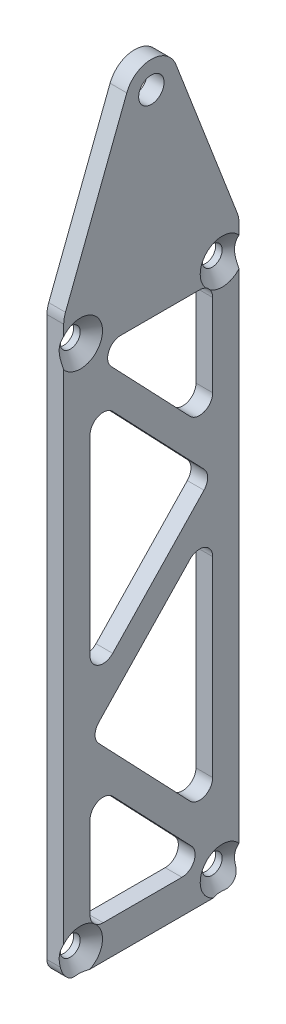
from build123d import *

# Parameters (mm, degrees)
SKETCH1_W                                 = 41.514809608
SKETCH1_H                                 = 98.81
SKETCH1_R                                 = 1.8288
SKETCH1_R_2                               = 2.413
BOSS_EXTRUDE1_DEPTH                       = 3.175
SKETCH2_W                                 = 4.112404804
SKETCH2_H                                 = 141.223
CUT_EXTRUDE1_DEPTH                        = 106.912542124
FILLET1_R                                 = 2.5
FILLET2_R                                 = 5
CSK_FOR_6_FLAT_HEAD_MACHINE_SCREW_2_COUNT = 2
CSK_FOR_6_FLAT_HEAD_MACHINE_SCREW_2_PITCH = 26.9494
CSK_FOR_6_FLAT_HEAD_MACHINE_SCREW_3_COUNT = 2
CSK_FOR_6_FLAT_HEAD_MACHINE_SCREW_3_PITCH = 103.567708096
CSK_FOR_6_FLAT_HEAD_MACHINE_SCREW_4_COUNT = 2
CSK_FOR_6_FLAT_HEAD_MACHINE_SCREW_4_PITCH = 100


with BuildPart() as part:
    # Sketch1 → Boss-Extrude1 (new body)
    # profile 1 of 6: a face of its own
    with BuildSketch(Plane(origin=(0, 0, 0), x_dir=(0, 0, -1), z_dir=(1, 0, 0))):
        with Locations((0, -54.405)):
            Rectangle(SKETCH1_W, SKETCH1_H)
        with Locations((13.4747, -100)):
            Circle(SKETCH1_R, mode=Mode.SUBTRACT)
        with Locations((-13.4747, -100)):
            Circle(SKETCH1_R, mode=Mode.SUBTRACT)
    # profile 2 of 6: a face of its own
    with BuildSketch(Plane(origin=(0, 0, 0), x_dir=(0, 0, -1), z_dir=(1, 0, 0))):
        Polygon((0, 48.916537522), (20.757404804, -5), (-20.757404804, -5), align=None)
        with Locations((13.4747, 0)):
            Circle(SKETCH1_R, mode=Mode.SUBTRACT)
        with Locations((0, 35)):
            Circle(SKETCH1_R_2, mode=Mode.SUBTRACT)
        with Locations((-13.4747, 0)):
            Circle(SKETCH1_R, mode=Mode.SUBTRACT)
    # profile 3 of 6: a face of its own
    with BuildSketch(Plane(origin=(0, 0, 0), x_dir=(0, 0, -1), z_dir=(1, 0, 0))):
        with Locations((-13.4747, 0)):
            Circle(SKETCH1_R)
    # profile 4 of 6: a face of its own
    with BuildSketch(Plane(origin=(0, 0, 0), x_dir=(0, 0, -1), z_dir=(1, 0, 0))):
        with Locations((13.4747, 0)):
            Circle(SKETCH1_R)
    # profile 5 of 6: a face of its own
    with BuildSketch(Plane(origin=(0, 0, 0), x_dir=(0, 0, -1), z_dir=(1, 0, 0))):
        with Locations((13.4747, -100)):
            Circle(SKETCH1_R)
    # profile 6 of 6: a face of its own
    with BuildSketch(Plane(origin=(0, 0, 0), x_dir=(0, 0, -1), z_dir=(1, 0, 0))):
        with Locations((-13.4747, -100)):
            Circle(SKETCH1_R)
    extrude(amount=BOSS_EXTRUDE1_DEPTH)

    # Sketch2 → Cut-Extrude1 (cut, through all)
    with BuildSketch(Plane(origin=(3.175, 0, 0), x_dir=(0, 0, -1), z_dir=(1, 0, 0))):
        Polygon((11.645, -2.5), (-11.645, -2.5), (11.645, -26.898674048), align=None)
        Polygon((-11.645, -9.741325952), (11.645, -34.14), (-11.645, -58.538674048), (-11.645, -34.14), align=None)
        Polygon((-11.645, -73.021325952), (-11.645, -97.42), (11.645, -97.42), align=None)
        Polygon((11.645, -41.381325952), (11.645, -65.78), (11.645, -90.178674048), (-11.645, -65.78), align=None)
        with Locations((-18.701202402, -33.1985)):
            Rectangle(SKETCH2_W, SKETCH2_H)
        with Locations((18.701202402, -33.1985)):
            Rectangle(SKETCH2_W, SKETCH2_H)
    extrude(amount=-CUT_EXTRUDE1_DEPTH, mode=Mode.SUBTRACT)

    # Fillet1
    fillet1_edges = [part.edges().sort_by_distance(p)[0] for p in [
        (1.5875, -103.81, -16.645),
        (1.5875, -9.741325952, 11.645),
        (1.5875, -34.14, -11.645),
        (1.5875, -58.538674048, 11.645),
        (1.5875, -26.898674048, -11.645),
        (1.5875, -2.5, 11.645),
        (1.5875, -2.5, -11.645),
        (1.5875, -90.178674048, -11.645),
        (1.5875, -65.78, 11.645),
        (1.5875, -41.381325952, -11.645),
        (1.5875, -103.81, 16.645),
        (1.5875, -73.021325952, 11.645),
        (1.5875, -97.42, -11.645),
        (1.5875, -97.42, 11.645),
    ]]
    fillet(fillet1_edges, radius=FILLET1_R)

    # Fillet2
    fillet2_edges = [part.edges().sort_by_distance(p)[0] for p in [
        (1.5875, 48.916537522, 0),
        (1.5875, 5.681808734, -16.645),
        (1.5875, 5.681808734, 16.645),
    ]]
    fillet(fillet2_edges, radius=FILLET2_R)

    # Sketch4 → CSK for #6 Flat Head Machine Screw (100)1 (revolve, cut)
    with BuildSketch(Plane(origin=(3.175, 0, 13.4747), x_dir=(0, 0, -1), z_dir=(0, 1, 0))):
        Polygon((0, 0), (0, 3.175), (1.89865, 3.175), (1.89865, 1.930031858), (4.1987724, 0), align=None)
    csk_for_6_flat_head_machine_screw_100 = revolve(axis=Axis((9.525, 0, 13.4747), (-1, 0, 0)), mode=Mode.SUBTRACT)

    # CSK for _6 Flat Head Machine Screw _ 2: CSK for #6 Flat Head Machine Screw (100)1 ×2
    with Locations(*[(0, 0, -i * CSK_FOR_6_FLAT_HEAD_MACHINE_SCREW_2_PITCH) for i in range(1, CSK_FOR_6_FLAT_HEAD_MACHINE_SCREW_2_COUNT)]):
        add(csk_for_6_flat_head_machine_screw_100, mode=Mode.SUBTRACT)

    # CSK for _6 Flat Head Machine Screw _ 3: CSK for #6 Flat Head Machine Screw (100)1 ×2
    with Locations(*[Vector(0, -0.9655519257685299, -0.2602104506830644) * (i * CSK_FOR_6_FLAT_HEAD_MACHINE_SCREW_3_PITCH) for i in range(1, CSK_FOR_6_FLAT_HEAD_MACHINE_SCREW_3_COUNT)]):
        add(csk_for_6_flat_head_machine_screw_100, mode=Mode.SUBTRACT)

    # CSK for _6 Flat Head Machine Screw _ 4: CSK for #6 Flat Head Machine Screw (100)1 ×2
    with Locations(*[(0, -i * CSK_FOR_6_FLAT_HEAD_MACHINE_SCREW_4_PITCH, 0) for i in range(1, CSK_FOR_6_FLAT_HEAD_MACHINE_SCREW_4_COUNT)]):
        add(csk_for_6_flat_head_machine_screw_100, mode=Mode.SUBTRACT)


solid = part.part
